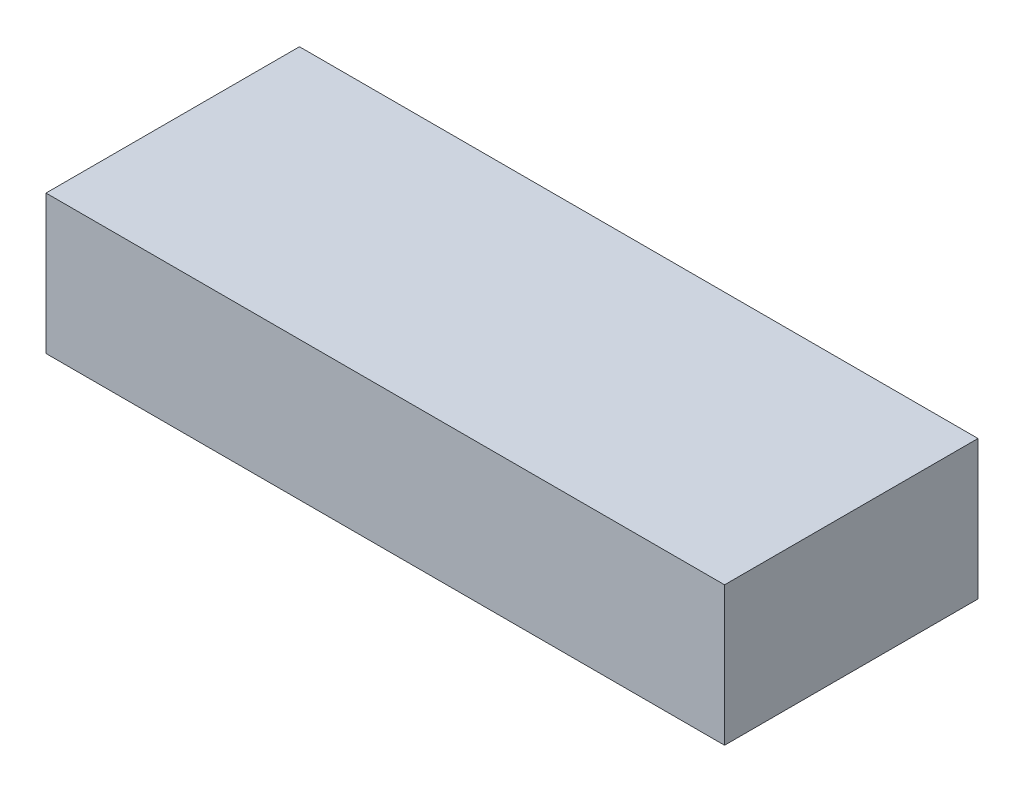
from build123d import *

# Parameters (mm, degrees)
SKETCH1_W           = 83
SKETCH1_H           = 17
BOSS_EXTRUDE1_DEPTH = 31


with BuildPart() as part:
    # Sketch1 → Boss-Extrude1 (new body)
    with BuildSketch(Plane.XY):
        with Locations((41.5, 8.5)):
            Rectangle(SKETCH1_W, SKETCH1_H)
    extrude(amount=BOSS_EXTRUDE1_DEPTH)


solid = part.part
